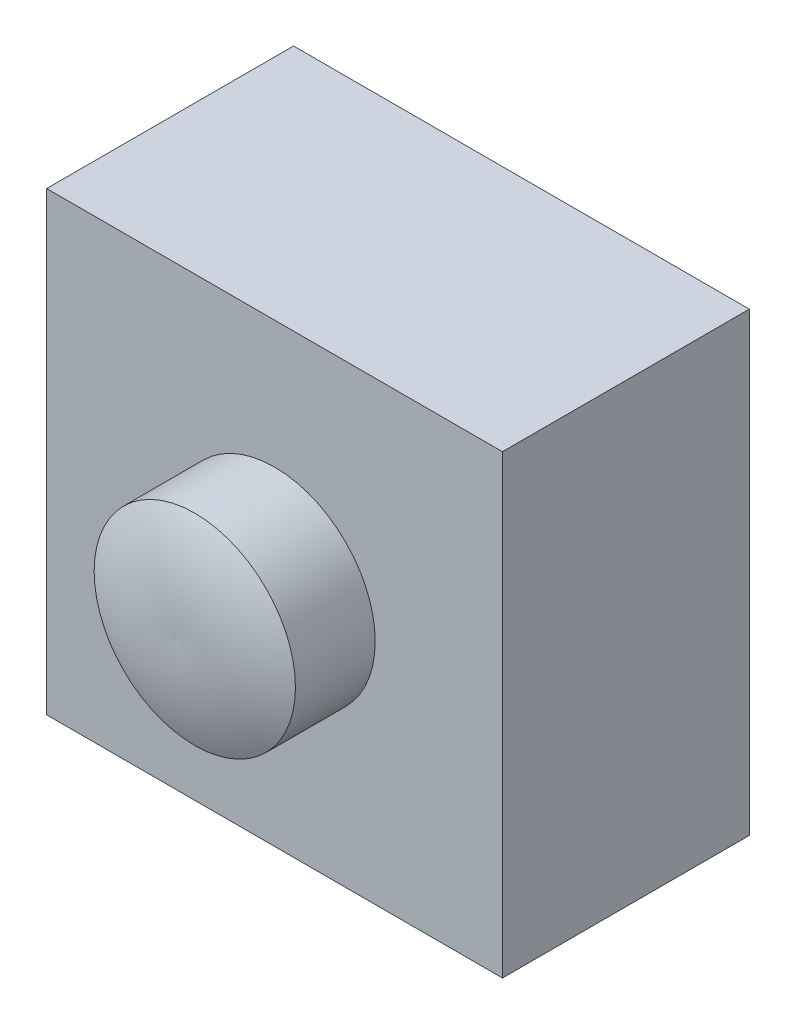
from build123d import *

# Parameters (mm, degrees)
SKETCH1_W           = 12
SKETCH1_H           = 12
BOSS_EXTRUDE1_DEPTH = 6.5
SKETCH5_W           = 1.6
SKETCH5_H           = 0.4
BOSS_EXTRUDE3_DEPTH = 0.5
SKETCH6_W           = 1.6
SKETCH6_H           = 0.4
BOSS_EXTRUDE4_DEPTH = 0.4
FILLET1_R           = 0.6
FILLET2_R           = 0.3


with BuildPart() as part:
    # Sketch1 → Boss-Extrude1 (new body)
    with BuildSketch(Plane.XY):
        with Locations((6, 6)):
            Rectangle(SKETCH1_W, SKETCH1_H)
    extrude(amount=BOSS_EXTRUDE1_DEPTH)

    # Sketch4 → Revolve1 (revolve)
    with BuildSketch(Plane(origin=(0, 6, 0), x_dir=(1, 0, 0), z_dir=(0, 1, 0))):
        with BuildLine():
            Line((3.35, -8.6), (3.35, -6.5))
            Line((3.35, -6.5), (6, -6.5))
            Line((6, -6.5), (6, -9.1))
            ThreePointArc((6, -9.1), (4.643872087, -9.014977939), (3.35, -8.6))
        make_face()
    revolve(axis=Axis((6, 6, 6.5), (0, 0, 1)))

    # Sketch5 → Boss-Extrude3 (add)
    with BuildSketch(Plane.XZ):
        with Locations((8.65, 3.4)):
            Rectangle(SKETCH5_W, SKETCH5_H)
        with Locations((3.35, 3.4)):
            Rectangle(SKETCH5_W, SKETCH5_H)
    extrude(amount=BOSS_EXTRUDE3_DEPTH)

    # Sketch6 → Boss-Extrude4 (add)
    with BuildSketch(Plane.XZ.offset(0.5)):
        with BuildLine():
            Line((2.95, 0), (2.95, -1.9))
            ThreePointArc((2.95, -1.9), (3.35, -2.2), (3.75, -1.9))
            Line((3.75, -1.9), (3.75, 0))
            Line((3.75, 0), (4.15, 0.4))
            Line((4.15, 0.4), (4.15, 3.2))
            Line((4.15, 3.2), (2.55, 3.2))
            Line((2.55, 3.2), (2.55, 0.4))
            Line((2.55, 0.4), (2.95, 0))
        make_face()
        with Locations((3.35, 3.4)):
            Rectangle(SKETCH6_W, SKETCH6_H)
        with BuildLine():
            ThreePointArc((9.05, -1.9), (8.65, -2.2), (8.25, -1.9))
            Line((8.25, -1.9), (8.25, 0))
            Line((8.25, 0), (7.85, 0.4))
            Line((7.85, 0.4), (7.85, 3.6))
            Line((7.85, 3.6), (9.45, 3.6))
            Line((9.45, 3.6), (9.45, 0.4))
            Line((9.45, 0.4), (9.05, 0))
            Line((9.05, 0), (9.05, -1.9))
        make_face()
    extrude(amount=BOSS_EXTRUDE4_DEPTH)

    # Fillet1
    fillet1_edges = [part.edges().sort_by_distance(p)[0] for p in [
        (3.35, -0.9, 3.6),
        (8.65, -0.9, 3.6),
    ]]
    fillet(fillet1_edges, radius=FILLET1_R)

    # Fillet2
    fillet2_edges = [part.edges().sort_by_distance(p)[0] for p in [
        (3.35, -0.5, 3.2),
        (8.65, -0.5, 3.2),
    ]]
    fillet(fillet2_edges, radius=FILLET2_R)


solid = part.part
